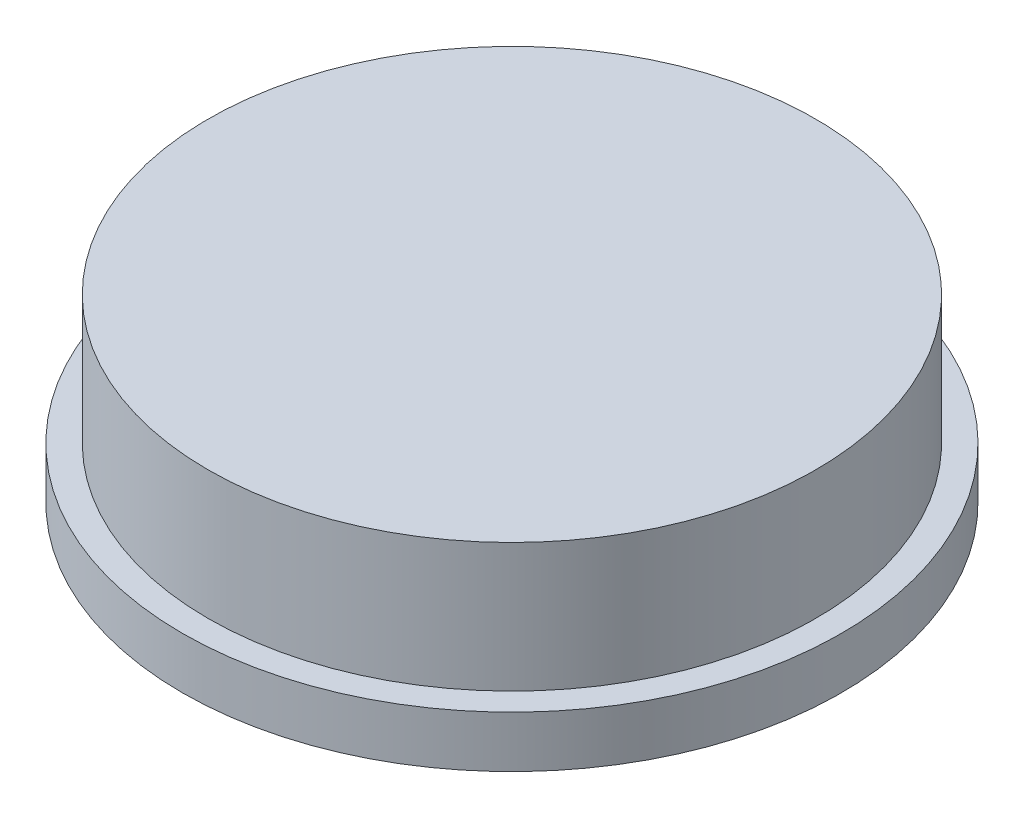
from build123d import *

# Parameters (mm, degrees)
SKETCH1_R           = 32.512
BOSS_EXTRUDE1_DEPTH = 5.08
SKETCH2_R           = 29.972
BOSS_EXTRUDE2_DEPTH = 12.7


with BuildPart() as part:
    # Sketch1 → Boss-Extrude1 (new body)
    with BuildSketch(Plane(origin=(0, 0, 0), x_dir=(1, 0, 0), z_dir=(0, 1, 0))):
        with Locations(Location((0, 0, 0), (0, 0, 270))):
            Circle(SKETCH1_R)
    extrude(amount=BOSS_EXTRUDE1_DEPTH)

    # Sketch2 → Boss-Extrude2 (add)
    with BuildSketch(Plane(origin=(0, 5.08, 0), x_dir=(1, 0, 0), z_dir=(0, 1, 0))):
        with Locations(Location((0, 0, 0), (0, 0, 270))):
            Circle(SKETCH2_R)
    extrude(amount=BOSS_EXTRUDE2_DEPTH)


solid = part.part
